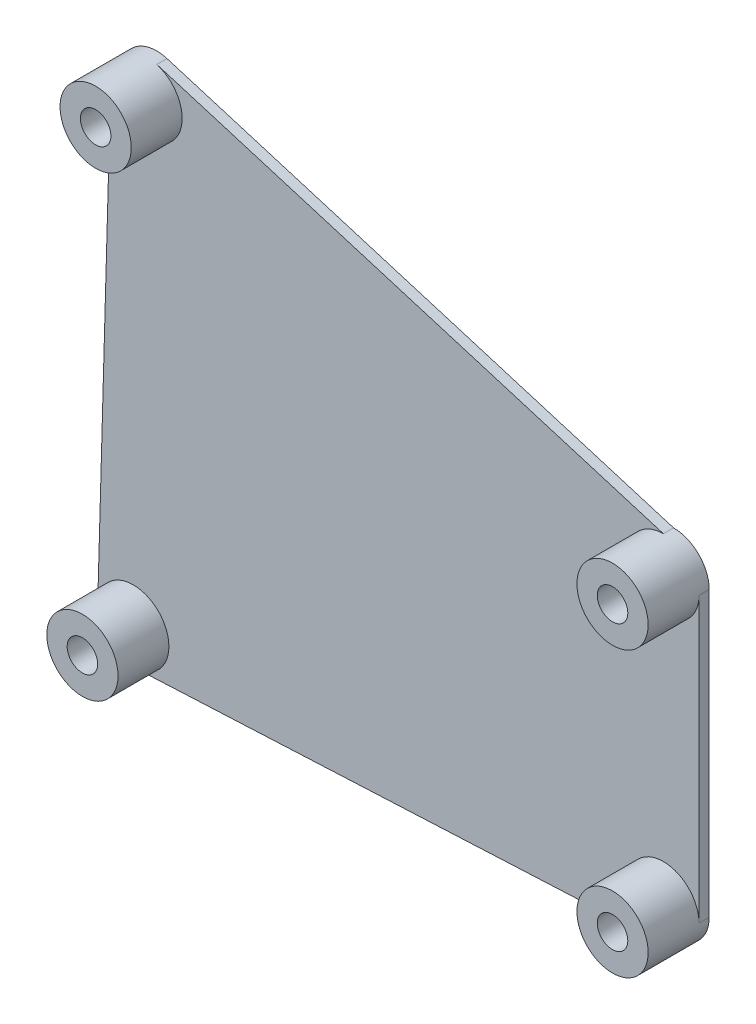
from build123d import *

# Parameters (mm, degrees)
SKETCH1_R           = 3.5
SKETCH1_R_2         = 1.5
BOSS_EXTRUDE2_DEPTH = 6
CUT_EXTRUDE2_DEPTH  = 5


with BuildPart() as part:
    # Sketch1 → Boss-Extrude2 (new body)
    # profile 1 of 5: a face of its own
    with BuildSketch(Plane.XY):
        with BuildLine():
            ThreePointArc((4.8, 45.6), (1.3, 42.1), (-2.2, 45.6))
            Line((-2.2, 45.6), (-3.49431537, 0.199399342))
            ThreePointArc((-3.49431537, 0.199399342), (0.099740178, 3.498578554), (3.5, 0))
            ThreePointArc((3.5, 0), (2.590648868, -2.353409961), (0.33512089, -3.483919343))
            Line((0.33512089, -3.483919343), (52.1, -1))
            ThreePointArc((52.1, -1), (49.625126266, 4.974873734), (55.6, 2.5))
            Line((55.6, 2.5), (55.6, 30.4))
            ThreePointArc((55.6, 30.4), (49.625126266, 27.925126266), (52.1, 33.9))
            Line((52.1, 33.9), (2.312759359, 48.950271404))
            ThreePointArc((2.312759359, 48.950271404), (4.110218653, 47.686305616), (4.8, 45.6))
        make_face()
    # profile 2 of 5: a face of its own
    with BuildSketch(Plane.XY):
        with Locations((1.3, 45.6)):
            Circle(SKETCH1_R)
        with Locations((1.3, 45.6)):
            Circle(SKETCH1_R_2, mode=Mode.SUBTRACT)
    # profile 3 of 5: a face of its own
    with BuildSketch(Plane.XY):
        with Locations((52.1, 30.4)):
            Circle(SKETCH1_R)
        with Locations((52.1, 30.4)):
            Circle(SKETCH1_R_2, mode=Mode.SUBTRACT)
    # profile 4 of 5: a face of its own
    with BuildSketch(Plane.XY):
        with Locations((52.1, 2.5)):
            Circle(SKETCH1_R)
        with Locations((52.1, 2.5)):
            Circle(SKETCH1_R_2, mode=Mode.SUBTRACT)
    # profile 5 of 5: a face of its own
    with BuildSketch(Plane.XY):
        with BuildLine():
            ThreePointArc((3.5, 0), (0.099740178, 3.498578554), (-3.49431537, 0.199399342))
            Line((-3.49431537, 0.199399342), (-3.5, 0))
            ThreePointArc((-3.5, 0), (-2.474873734, -2.474873734), (0, -3.5))
            Line((0, -3.5), (0.33512089, -3.483919343))
            ThreePointArc((0.33512089, -3.483919343), (2.590648868, -2.353409961), (3.5, 0))
        make_face()
        Circle(SKETCH1_R_2, mode=Mode.SUBTRACT)
    extrude(amount=-BOSS_EXTRUDE2_DEPTH)

    # Sketch1<3> → Cut-Extrude2 (cut)
    with BuildSketch(Plane.XY):
        with BuildLine():
            ThreePointArc((4.8, 45.6), (1.3, 42.1), (-2.2, 45.6))
            Line((-2.2, 45.6), (-3.49431537, 0.199399342))
            ThreePointArc((-3.49431537, 0.199399342), (0.099740178, 3.498578554), (3.5, 0))
            ThreePointArc((3.5, 0), (2.590648868, -2.353409961), (0.33512089, -3.483919343))
            Line((0.33512089, -3.483919343), (52.1, -1))
            ThreePointArc((52.1, -1), (49.625126266, 4.974873734), (55.6, 2.5))
            Line((55.6, 2.5), (55.6, 30.4))
            ThreePointArc((55.6, 30.4), (49.625126266, 27.925126266), (52.1, 33.9))
            Line((52.1, 33.9), (2.312759359, 48.950271404))
            ThreePointArc((2.312759359, 48.950271404), (4.110218653, 47.686305616), (4.8, 45.6))
        make_face()
    extrude(amount=-CUT_EXTRUDE2_DEPTH, mode=Mode.SUBTRACT)


solid = part.part
